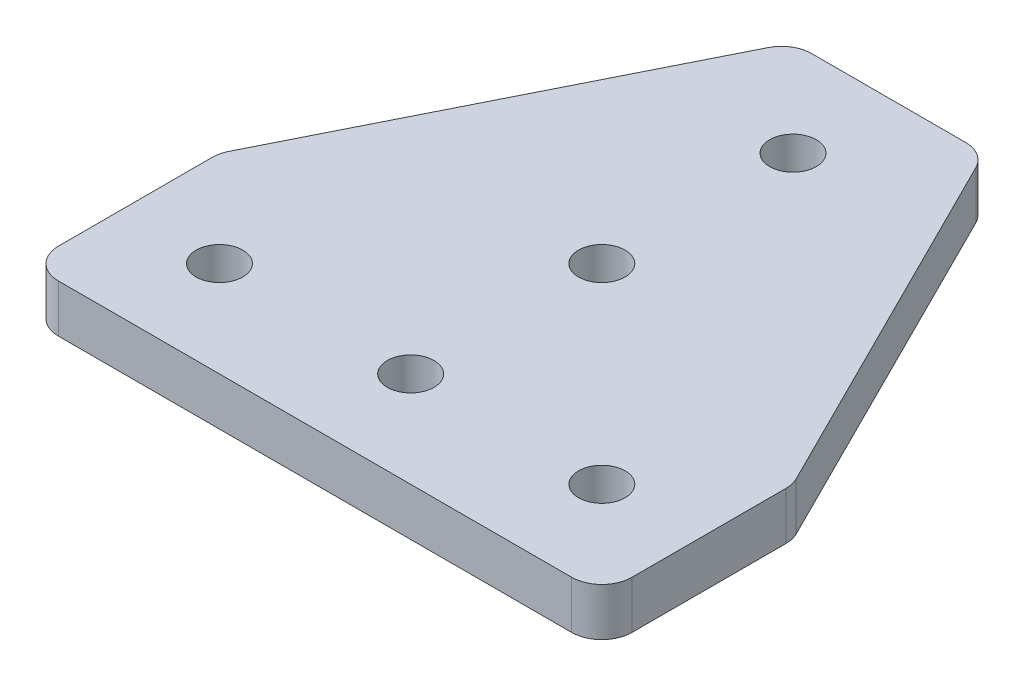
from build123d import *

# Parameters (mm, degrees)
SKETCH1_R           = 3.1
BOSS_EXTRUDE1_DEPTH = 6.35
FILLET1_R           = 4


with BuildPart() as part:
    # Sketch1 → Boss-Extrude1 (new body)
    with BuildSketch(Plane(origin=(0, 0, 0), x_dir=(1, 0, 0), z_dir=(0, 1, 0))):
        Polygon((0, -12.7), (-38.1, -12.7), (-38.1, 12.7), (-12.7, 63.5), (12.7, 63.5), (38.1, 12.7), (38.1, -12.7), align=None)
        with Locations(Location((0, 50.8, 0), (0, 0, 270))):
            Circle(SKETCH1_R, mode=Mode.SUBTRACT)
        with Locations(Location((0, 25.4, 0), (0, 0, 270))):
            Circle(SKETCH1_R, mode=Mode.SUBTRACT)
        with Locations(Location((25.4, 0, 0), (0, 0, 270))):
            Circle(SKETCH1_R, mode=Mode.SUBTRACT)
        with Locations(Location((0, 0, 0), (0, 0, 270))):
            Circle(SKETCH1_R, mode=Mode.SUBTRACT)
        with Locations(Location((-25.4, 0, 0), (0, 0, 270))):
            Circle(SKETCH1_R, mode=Mode.SUBTRACT)
    extrude(amount=BOSS_EXTRUDE1_DEPTH)

    # Fillet1
    fillet1_edges = [part.edges().sort_by_distance(p)[0] for p in [
        (-38.1, 3.175, 12.7),
        (-38.1, 3.175, -12.7),
        (-12.7, 3.175, -63.5),
        (12.7, 3.175, -63.5),
        (38.1, 3.175, -12.7),
        (38.1, 3.175, 12.7),
    ]]
    fillet(fillet1_edges, radius=FILLET1_R)


solid = part.part
